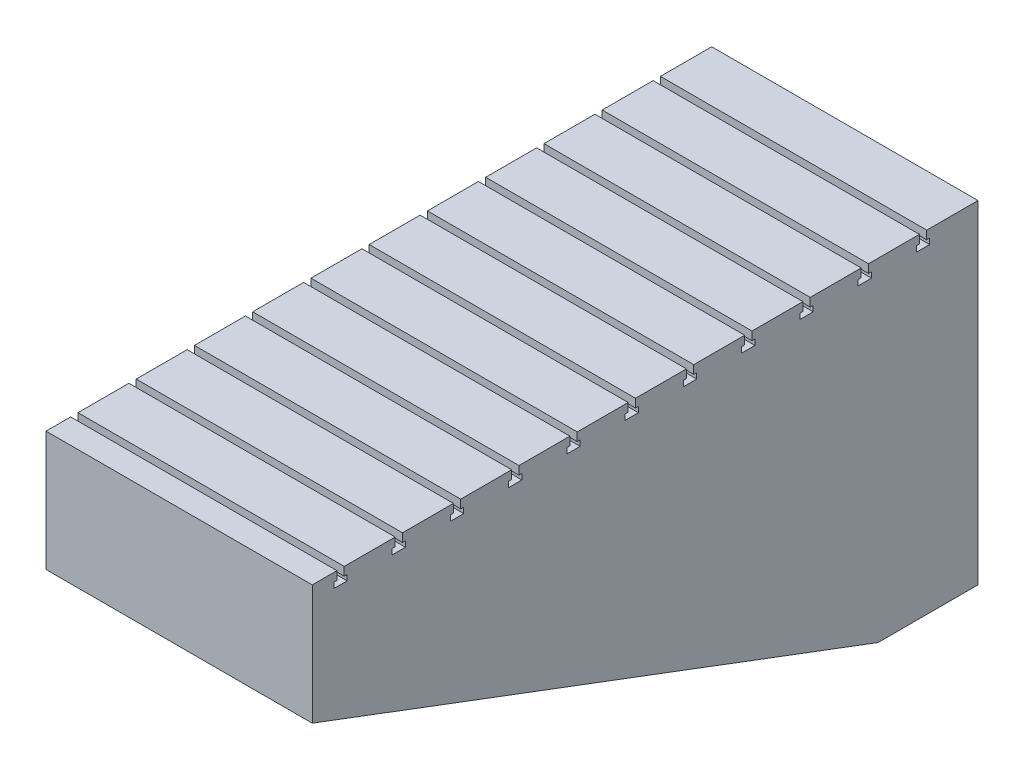
from build123d import *

# Parameters (mm, degrees)
BOSS_EXTRUDE1_DEPTH = 800
CUT_EXTRUDE1_REACH  = 2376.868
LPATTERN1_COUNT     = 11
LPATTERN1_PITCH     = 175


with BuildPart() as part:
    # Sketch4 → Boss-Extrude1 (new body)
    with BuildSketch(Plane(origin=(0, 0, 0), x_dir=(0, 0, -1), z_dir=(1, 0, 0))):
        Polygon((0, 0), (-2000, 0), (-2000, -360), (-300, -1000), (0, -1000), align=None)
    extrude(amount=BOSS_EXTRUDE1_DEPTH)

    # Sketch6 → Cut-Extrude1 (cut, up to next)
    with BuildSketch(Plane(origin=(0, 0, 0), x_dir=(0, 0, -1), z_dir=(1, 0, 0)), mode=Mode.PRIVATE) as cut_extrude1_sk1:
        Polygon((-154, 0), (-176, 0), (-176, -25.3), (-184.85, -25.3), (-184.85, -42), (-145.15, -42), (-145.15, -25.3), (-154, -25.3), align=None)
    cut_extrude1_tool1 = extrude(cut_extrude1_sk1.sketch, amount=CUT_EXTRUDE1_REACH, mode=Mode.PRIVATE) & part.part
    cut_extrude1 = cut_extrude1_tool1.solids().sort_by_distance((0, -24.065959, 165))[0]
    add(cut_extrude1, mode=Mode.SUBTRACT)

    # LPattern1: Cut-Extrude1 ×11
    with Locations(*[(0, 0, i * LPATTERN1_PITCH) for i in range(1, LPATTERN1_COUNT)]):
        add(cut_extrude1, mode=Mode.SUBTRACT)


solid = part.part
